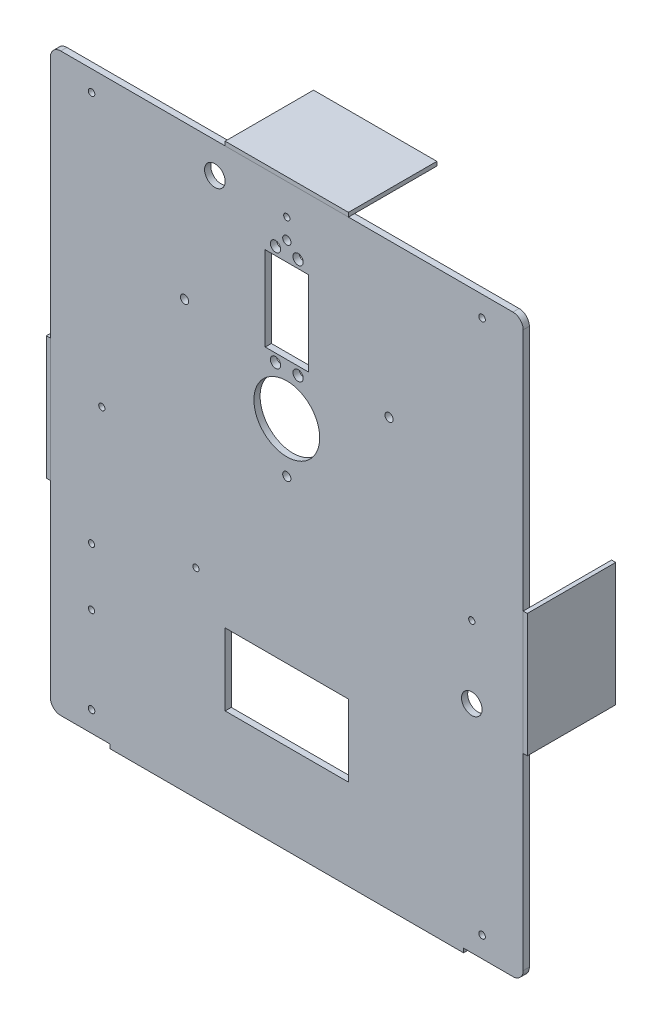
from build123d import *

# Parameters (mm, degrees)
SKETCH_1_R        = 2
SKETCH_1_R_2      = 1.6
SKETCH_1_R_3      = 2.5
SKETCH_1_R_4      = 16
SKETCH_1_R_5      = 1.5
SKETCH_1_R_6      = 1.51
SKETCH_1_R_7      = 5
SKETCH_1_W        = 21
SKETCH_1_H        = 41
SKETCH_1_W_2      = 60
SKETCH_1_H_2      = 35
EXTRUDE_1_DEPTH   = 3
SKETCH_2_W        = 2
SKETCH_2_H        = 60
EXTRUDE_2_DEPTH   = 43
EXTRUDE_2_2_DEPTH = 43
SKETCH_2_W_2      = 60
SKETCH_2_H_2      = 2
EXTRUDE_2_3_DEPTH = 43
SKETCH_3_W        = 172
SKETCH_3_H        = 2
EXTRUDE_3_DEPTH   = 13


with BuildPart() as part:
    # 草图1 → 凸台-拉伸1 (new body)
    with BuildSketch(Plane.XY):
        with BuildLine():
            Line((105, -140), (-105, -140))
            Line((-105, -140), (-110, -140))
            ThreePointArc((-110, -140), (-113.535533906, -138.535533906), (-115, -135))
            Line((-115, -135), (-115, -130))
            Line((-115, -130), (-115, 130))
            Line((-115, 130), (-115, 135))
            ThreePointArc((-115, 135), (-113.535533906, 138.535533906), (-110, 140))
            Line((-110, 140), (-105, 140))
            Line((-105, 140), (105, 140))
            Line((105, 140), (110, 140))
            ThreePointArc((110, 140), (113.535533906, 138.535533906), (115, 135))
            Line((115, 135), (115, 130))
            Line((115, 130), (115, -130))
            Line((115, -130), (115, -135))
            ThreePointArc((115, -135), (113.535533906, -138.535533906), (110, -140))
            Line((110, -140), (105, -140))
        make_face()
        with Locations((0, 115.25)):
            Circle(SKETCH_1_R, mode=Mode.SUBTRACT)
        with Locations((-49.75, 65.5)):
            Circle(SKETCH_1_R, mode=Mode.SUBTRACT)
        with Locations((0, 15.75)):
            Circle(SKETCH_1_R, mode=Mode.SUBTRACT)
        with Locations((49.75, 65.5)):
            Circle(SKETCH_1_R, mode=Mode.SUBTRACT)
        with Locations((-95, -130)):
            Circle(SKETCH_1_R_2, mode=Mode.SUBTRACT)
        with Locations((95, -130)):
            Circle(SKETCH_1_R_2, mode=Mode.SUBTRACT)
        with Locations((-95, 130)):
            Circle(SKETCH_1_R_2, mode=Mode.SUBTRACT)
        with Locations((95, 130)):
            Circle(SKETCH_1_R_2, mode=Mode.SUBTRACT)
        with Locations((-5.5, 61.05)):
            Circle(SKETCH_1_R_3, mode=Mode.SUBTRACT)
        with Locations((5.5, 61.05)):
            Circle(SKETCH_1_R_3, mode=Mode.SUBTRACT)
        with Locations(Location((5.5, 109.95, 0), (0, 0, 180))):
            Circle(SKETCH_1_R_3, mode=Mode.SUBTRACT)
        with Locations(Location((-5.5, 109.95, 0), (0, 0, 180))):
            Circle(SKETCH_1_R_3, mode=Mode.SUBTRACT)
        with Locations((0, 40)):
            Circle(SKETCH_1_R_4, mode=Mode.SUBTRACT)
        with Locations((-95, -87.958075064)):
            Circle(SKETCH_1_R_5, mode=Mode.SUBTRACT)
        with Locations((-95, -60.058075064)):
            Circle(SKETCH_1_R_5, mode=Mode.SUBTRACT)
        with Locations((-44.2, -44.858075064)):
            Circle(SKETCH_1_R_5, mode=Mode.SUBTRACT)
        with Locations((-90, 0)):
            Circle(SKETCH_1_R_6, mode=Mode.SUBTRACT)
        with Locations(Location((90, 0, 0), (0, 0, 180))):
            Circle(SKETCH_1_R_6, mode=Mode.SUBTRACT)
        with Locations((0, 125)):
            Circle(SKETCH_1_R_6, mode=Mode.SUBTRACT)
        with Locations((-35, 125)):
            Circle(SKETCH_1_R_7, mode=Mode.SUBTRACT)
        with Locations((90, -35)):
            Circle(SKETCH_1_R_7, mode=Mode.SUBTRACT)
        with Locations((0, 85.5)):
            Rectangle(SKETCH_1_W, SKETCH_1_H, mode=Mode.SUBTRACT)
        with Locations((0, -80.572838145)):
            Rectangle(SKETCH_1_W_2, SKETCH_1_H_2, mode=Mode.SUBTRACT)
    extrude(amount=EXTRUDE_1_DEPTH)

    # 草图3 → 凸台-拉伸3 (add)
    with BuildSketch(Plane.XY.offset(3)):
        with Locations((0, -141)):
            Rectangle(SKETCH_3_W, SKETCH_3_H)
    extrude(amount=-EXTRUDE_3_DEPTH)


with BuildPart() as body_2:
    # 草图2 → 凸台-拉伸2 (new body)
    with BuildSketch(Plane.XY.offset(3)):
        with Locations((-116, -13.491825151)):
            Rectangle(SKETCH_2_W, SKETCH_2_H)
    extrude(amount=-EXTRUDE_2_DEPTH)


with BuildPart() as body_3:
    # 草图2 → Extrude 2 2 (new body)
    with BuildSketch(Plane.XY.offset(3)):
        with Locations((116, -13.491825151)):
            Rectangle(SKETCH_2_W, SKETCH_2_H)
    extrude(amount=-EXTRUDE_2_2_DEPTH)


with BuildPart() as body_4:
    # 草图2 → Extrude 2 3 (new body)
    with BuildSketch(Plane.XY.offset(3)):
        with Locations((0, 141)):
            Rectangle(SKETCH_2_W_2, SKETCH_2_H_2)
    extrude(amount=-EXTRUDE_2_3_DEPTH)


solid = Compound([part.part, body_2.part, body_3.part, body_4.part])
